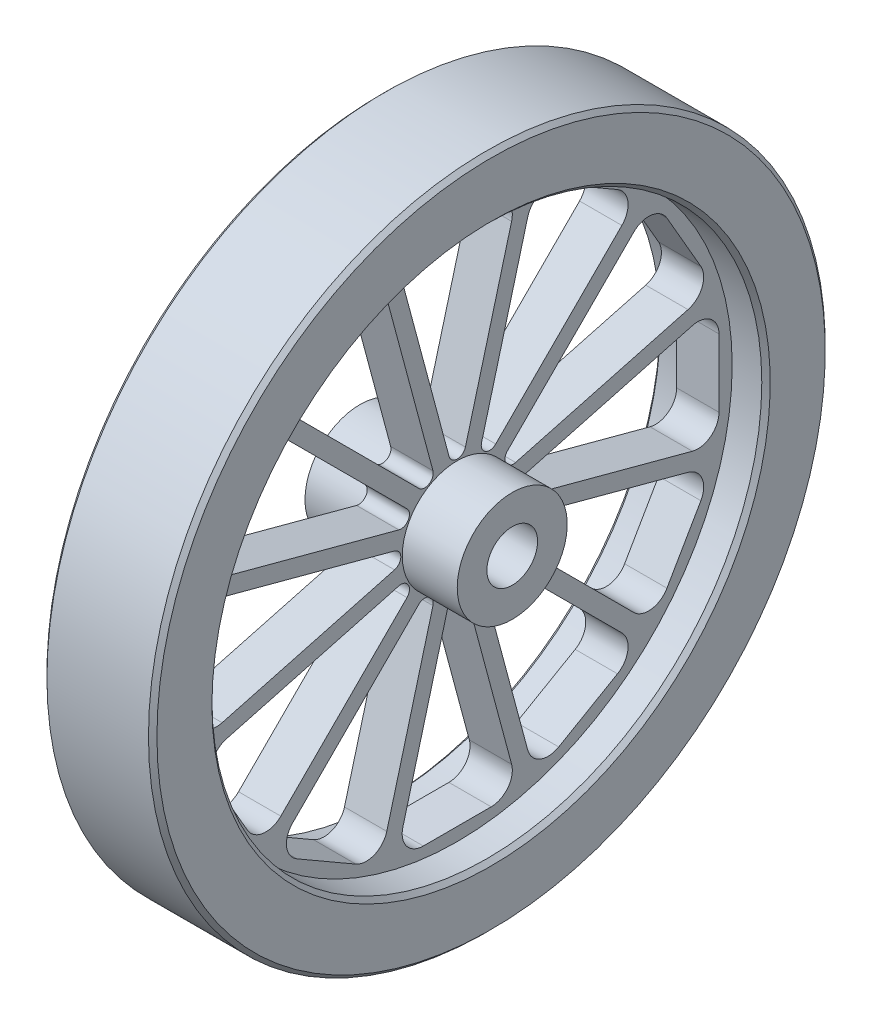
from build123d import *

# Parameters (mm, degrees)
CUT_EXTRUDE1_DEPTH = 20
CHAMFER1_SIZE      = 1


with BuildPart() as part:
    # Sketch1 → Revolve1 (revolve)
    with BuildSketch(Plane.XY, mode=Mode.PRIVATE) as revolve1_sk:
        Polygon((-18, 6), (18, 6), (18, 13), (5, 13), (5, 65), (13, 65), (13, 80), (-13, 80), (-13, 65), (-5, 65), (-5, 13), (-18, 13), align=None)
    revolve(revolve1_sk.sketch.rotate(Axis((0, 0, 0), (1, 0, 0)), 90), axis=Axis((0, 0, 0), (1, 0, 0)))

    # Sketch2 → Cut-Extrude1 (cut)
    with BuildSketch(Plane.ZY.offset(5)):
        with BuildLine():
            Line((-8.022576871, 61.874894191), (8.022576871, 61.874894191))
            ThreePointArc((8.022576871, 61.874894191), (11.989343573, 59.918701336), (12.852206003, 55.580798966))
            Line((12.852206003, 55.580798966), (1.931851653, 14.825481694))
            ThreePointArc((1.931851653, 14.825481694), (0, 13.343119784), (-1.931851653, 14.825481694))
            Line((-1.931851653, 14.825481694), (-12.852206003, 55.580798966))
            ThreePointArc((-12.852206003, 55.580798966), (-11.989343573, 59.918701336), (-8.022576871, 61.874894191))
        make_face()
        with BuildLine():
            Line((23.989691721, 57.596518662), (37.88520247, 49.57394179))
            ThreePointArc((37.88520247, 49.57394179), (40.342426777, 45.896445733), (38.920736376, 41.708280866))
            Line((38.920736376, 41.708280866), (9.085773454, 11.873317944))
            ThreePointArc((9.085773454, 11.873317944), (6.671559892, 11.555480699), (5.73970824, 13.805169597))
            Line((5.73970824, 13.805169597), (16.66006259, 54.560486868))
            ThreePointArc((16.66006259, 54.560486868), (19.576274559, 57.885789305), (23.989691721, 57.596518662))
        make_face()
        with BuildLine():
            Line((49.57394179, 37.88520247), (57.596518662, 23.989691721))
            ThreePointArc((57.596518662, 23.989691721), (57.885789305, 19.576274559), (54.560486868, 16.66006259))
            Line((54.560486868, 16.66006259), (13.805169597, 5.73970824))
            ThreePointArc((13.805169597, 5.73970824), (11.555480699, 6.671559892), (11.873317944, 9.085773454))
            Line((11.873317944, 9.085773454), (41.708280866, 38.920736376))
            ThreePointArc((41.708280866, 38.920736376), (45.896445733, 40.342426777), (49.57394179, 37.88520247))
        make_face()
        with BuildLine():
            Line((61.874894191, 8.022576871), (61.874894191, -8.022576871))
            ThreePointArc((61.874894191, -8.022576871), (59.918701336, -11.989343573), (55.580798966, -12.852206003))
            Line((55.580798966, -12.852206003), (14.825481694, -1.931851653))
            ThreePointArc((14.825481694, -1.931851653), (13.343119784, 0), (14.825481694, 1.931851653))
            Line((14.825481694, 1.931851653), (55.580798966, 12.852206003))
            ThreePointArc((55.580798966, 12.852206003), (59.918701336, 11.989343573), (61.874894191, 8.022576871))
        make_face()
        with BuildLine():
            Line((57.596518662, -23.989691721), (49.57394179, -37.88520247))
            ThreePointArc((49.57394179, -37.88520247), (45.896445733, -40.342426777), (41.708280866, -38.920736376))
            Line((41.708280866, -38.920736376), (11.873317944, -9.085773454))
            ThreePointArc((11.873317944, -9.085773454), (11.555480699, -6.671559892), (13.805169597, -5.73970824))
            Line((13.805169597, -5.73970824), (54.560486868, -16.66006259))
            ThreePointArc((54.560486868, -16.66006259), (57.885789305, -19.576274559), (57.596518662, -23.989691721))
        make_face()
        with BuildLine():
            Line((37.88520247, -49.57394179), (23.989691721, -57.596518662))
            ThreePointArc((23.989691721, -57.596518662), (19.576274559, -57.885789305), (16.66006259, -54.560486868))
            Line((16.66006259, -54.560486868), (5.73970824, -13.805169597))
            ThreePointArc((5.73970824, -13.805169597), (6.671559892, -11.555480699), (9.085773454, -11.873317944))
            Line((9.085773454, -11.873317944), (38.920736376, -41.708280866))
            ThreePointArc((38.920736376, -41.708280866), (40.342426777, -45.896445733), (37.88520247, -49.57394179))
        make_face()
        with BuildLine():
            Line((8.022576871, -61.874894191), (-8.022576871, -61.874894191))
            ThreePointArc((-8.022576871, -61.874894191), (-11.989343573, -59.918701336), (-12.852206003, -55.580798966))
            Line((-12.852206003, -55.580798966), (-1.931851653, -14.825481694))
            ThreePointArc((-1.931851653, -14.825481694), (0, -13.343119784), (1.931851653, -14.825481694))
            Line((1.931851653, -14.825481694), (12.852206003, -55.580798966))
            ThreePointArc((12.852206003, -55.580798966), (11.989343573, -59.918701336), (8.022576871, -61.874894191))
        make_face()
        with BuildLine():
            Line((-23.989691721, -57.596518662), (-37.88520247, -49.57394179))
            ThreePointArc((-37.88520247, -49.57394179), (-40.342426777, -45.896445733), (-38.920736376, -41.708280866))
            Line((-38.920736376, -41.708280866), (-9.085773454, -11.873317944))
            ThreePointArc((-9.085773454, -11.873317944), (-6.671559892, -11.555480699), (-5.73970824, -13.805169597))
            Line((-5.73970824, -13.805169597), (-16.66006259, -54.560486868))
            ThreePointArc((-16.66006259, -54.560486868), (-19.576274559, -57.885789305), (-23.989691721, -57.596518662))
        make_face()
        with BuildLine():
            Line((-49.57394179, -37.88520247), (-57.596518662, -23.989691721))
            ThreePointArc((-57.596518662, -23.989691721), (-57.885789305, -19.576274559), (-54.560486868, -16.66006259))
            Line((-54.560486868, -16.66006259), (-13.805169597, -5.73970824))
            ThreePointArc((-13.805169597, -5.73970824), (-11.555480699, -6.671559892), (-11.873317944, -9.085773454))
            Line((-11.873317944, -9.085773454), (-41.708280866, -38.920736376))
            ThreePointArc((-41.708280866, -38.920736376), (-45.896445733, -40.342426777), (-49.57394179, -37.88520247))
        make_face()
        with BuildLine():
            Line((-61.874894191, -8.022576871), (-61.874894191, 8.022576871))
            ThreePointArc((-61.874894191, 8.022576871), (-59.918701336, 11.989343573), (-55.580798966, 12.852206003))
            Line((-55.580798966, 12.852206003), (-14.825481694, 1.931851653))
            ThreePointArc((-14.825481694, 1.931851653), (-13.343119784, 0), (-14.825481694, -1.931851653))
            Line((-14.825481694, -1.931851653), (-55.580798966, -12.852206003))
            ThreePointArc((-55.580798966, -12.852206003), (-59.918701336, -11.989343573), (-61.874894191, -8.022576871))
        make_face()
        with BuildLine():
            Line((-57.596518662, 23.989691721), (-49.57394179, 37.88520247))
            ThreePointArc((-49.57394179, 37.88520247), (-45.896445733, 40.342426777), (-41.708280866, 38.920736376))
            Line((-41.708280866, 38.920736376), (-11.873317944, 9.085773454))
            ThreePointArc((-11.873317944, 9.085773454), (-11.555480699, 6.671559892), (-13.805169597, 5.73970824))
            Line((-13.805169597, 5.73970824), (-54.560486868, 16.66006259))
            ThreePointArc((-54.560486868, 16.66006259), (-57.885789305, 19.576274559), (-57.596518662, 23.989691721))
        make_face()
        with BuildLine():
            Line((-37.88520247, 49.57394179), (-23.989691721, 57.596518662))
            ThreePointArc((-23.989691721, 57.596518662), (-19.576274559, 57.885789305), (-16.66006259, 54.560486868))
            Line((-16.66006259, 54.560486868), (-5.73970824, 13.805169597))
            ThreePointArc((-5.73970824, 13.805169597), (-6.671559892, 11.555480699), (-9.085773454, 11.873317944))
            Line((-9.085773454, 11.873317944), (-38.920736376, 41.708280866))
            ThreePointArc((-38.920736376, 41.708280866), (-40.342426777, 45.896445733), (-37.88520247, 49.57394179))
        make_face()
    extrude(amount=-CUT_EXTRUDE1_DEPTH, mode=Mode.SUBTRACT)

    # Chamfer1
    chamfer1_edges = [part.edges().sort_by_distance(p)[0] for p in [
        (-13, 0, -65),
        (-13, 0, -80),
        (13, 0, -80),
        (13, 0, -65),
    ]]
    chamfer(chamfer1_edges, length=CHAMFER1_SIZE)


solid = part.part
